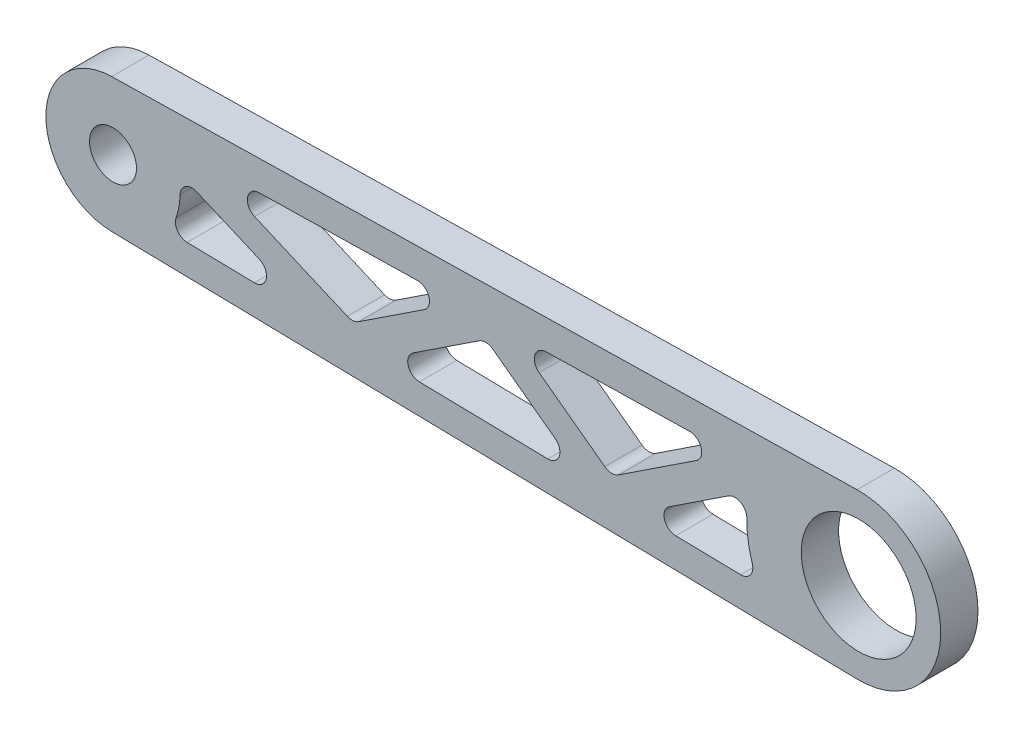
from build123d import *

# Parameters (mm, degrees)
EXTRUDE_1_DEPTH     = 5
SKETCH_2_R          = 3.15
CUT_EXTRUDE_1_DEPTH = 112.655720857
SKETCH_3_R          = 7.7
CUT_EXTRUDE_2_DEPTH = 112.655720857
CUT_EXTRUDE_3_DEPTH = 112.655720857
EXTRUDE_1_2_DEPTH   = 5
FILLET_1_R          = 1.6


with BuildPart() as part:
    # 草图1 → Extrude 1 (new body)
    with BuildSketch(Plane.XY):
        with BuildLine():
            Line((-0.18, -8.99819982), (99.78, -10.99779978))
            ThreePointArc((99.78, -10.99779978), (111, 0), (99.78, 10.99779978))
            Line((99.78, 10.99779978), (-0.18, 8.99819982))
            ThreePointArc((-0.18, 8.99819982), (-9, 0), (-0.18, -8.99819982))
        make_face()
    extrude(amount=EXTRUDE_1_DEPTH)

    # 草图2 → 切除-拉伸1 (cut, through all)
    with BuildSketch(Plane.XY.offset(5)):
        Circle(SKETCH_2_R)
    extrude(amount=-CUT_EXTRUDE_1_DEPTH, mode=Mode.SUBTRACT)

    # 草图3 → 切除-拉伸2 (cut, through all)
    with BuildSketch(Plane.XY.offset(5)):
        with Locations((100, 0)):
            Circle(SKETCH_3_R)
    extrude(amount=-CUT_EXTRUDE_2_DEPTH, mode=Mode.SUBTRACT)

    # 草图4 → 切除-拉伸3 (cut, through all)
    with BuildSketch(Plane.XY.offset(5)):
        with BuildLine():
            Line((7.381817961, 5.148666195), (86.596154404, 6.733269877))
            ThreePointArc((86.596154404, 6.733269877), (85, 0), (86.596154404, -6.733269877))
            Line((86.596154404, -6.733269877), (7.381817961, -5.148666195))
            ThreePointArc((7.381817961, -5.148666195), (9, 0), (7.381817961, 5.148666195))
        make_face()
    extrude(amount=-CUT_EXTRUDE_3_DEPTH, mode=Mode.SUBTRACT)

    # 草图5 → Extrude 1 2 (add, through all)
    with BuildSketch(Plane.XY.offset(5)):
        Polygon((6.589719105, 3.31220781), (32.616219561, -7.91350871), (50.030218058, 3.564346875), (66.717027477, -8.776023625), (87.697436335, 5.063785493), (85.494872472, 8.40275426), (66.847877099, -3.897809486), (50.161963875, 8.441898252), (32.217750586, -3.385430707), (8.173916817, 6.985124581), align=None)
    extrude(amount=-EXTRUDE_1_2_DEPTH)

    # 圆角1
    fillet_1_edges = [part.edges().sort_by_distance(p)[0] for p in [
        (7.381817961, -5.148666195, 2.5),
        (86.596154404, -6.733269877, 2.5),
        (27.121513236, -5.543539083, 2.5),
        (35.944131409, -5.720026748, 2.5),
        (63.325320924, -6.267760096, 2.5),
        (70.307680542, -6.407435226, 2.5),
        (82.850434699, 6.658340495, 2.5),
        (53.37111962, 6.068636241, 2.5),
        (46.348147736, 5.928148703, 2.5),
        (12.20786682, 5.245206483, 2.5),
        (32.217750586, -3.385430707, 2.5),
        (66.847877099, -3.897809486, 2.5),
        (85.430653574, 3.56849334, 2.5),
        (50.030218058, 3.564346875, 2.5),
        (8.669944071, 2.414967867, 2.5),
    ]]
    fillet(fillet_1_edges, radius=FILLET_1_R)


solid = part.part
